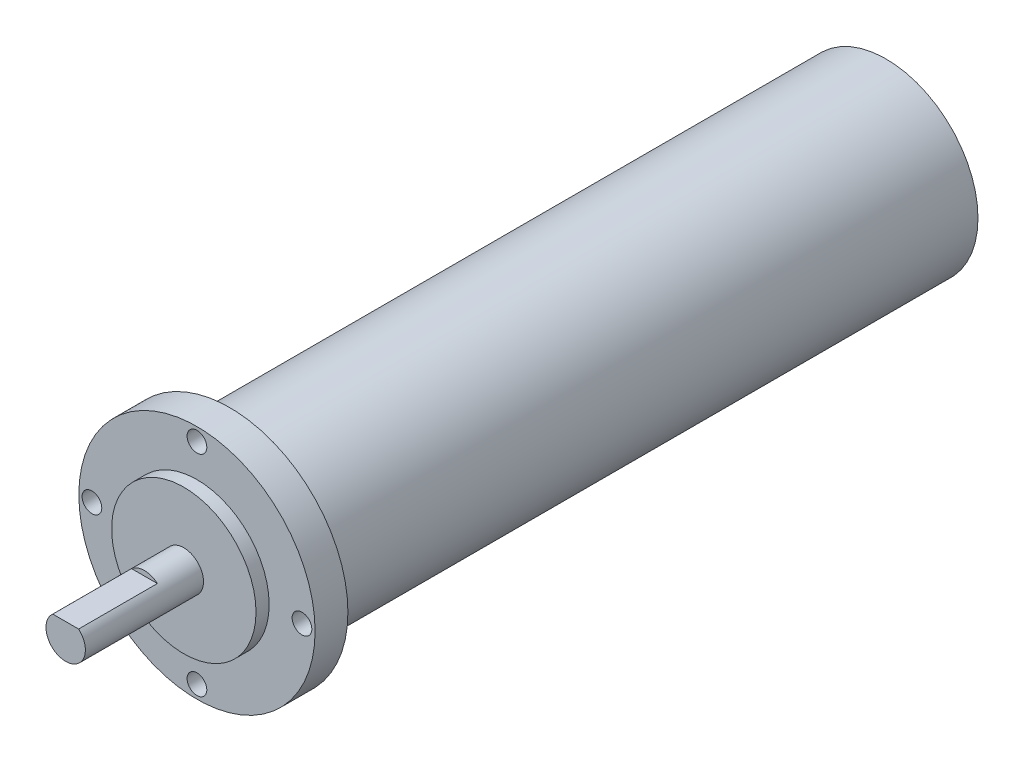
from build123d import *
from build123d.topology import SkipClean

# Parameters (mm, degrees)
SKETCH1_R           = 14
BOSS_EXTRUDE1_DEPTH = 100
SKETCH3_R           = 18
SKETCH3_R_2         = 1.5
BOSS_EXTRUDE2_DEPTH = 5
SKETCH4_R           = 11
BOSS_EXTRUDE3_DEPTH = 2
SKETCH5_R           = 3
BOSS_EXTRUDE4_DEPTH = 6
BOSS_EXTRUDE5_DEPTH = 18


with BuildPart() as part:
    # Sketch1 → Boss-Extrude1 (new body)
    with BuildSketch(Plane.XY):
        Circle(SKETCH1_R)
    extrude(amount=BOSS_EXTRUDE1_DEPTH)

    # Sketch3 → Boss-Extrude2 (add)
    with BuildSketch(Plane.XY.offset(100)):
        Circle(SKETCH3_R)
        with Locations((16, 0)):
            Circle(SKETCH3_R_2, mode=Mode.SUBTRACT)
        with Locations((0, 16)):
            Circle(SKETCH3_R_2, mode=Mode.SUBTRACT)
        with Locations((-16, 0)):
            Circle(SKETCH3_R_2, mode=Mode.SUBTRACT)
        with Locations((0, -16)):
            Circle(SKETCH3_R_2, mode=Mode.SUBTRACT)
    extrude(amount=BOSS_EXTRUDE2_DEPTH)


with BuildPart() as body_2:
    # Sketch4 → Boss-Extrude3 (new body)
    with BuildSketch(Plane.XY.offset(105)):
        Circle(SKETCH4_R)
    extrude(amount=BOSS_EXTRUDE3_DEPTH)

    # Sketch5 → Boss-Extrude4 (add)
    with BuildSketch(Plane.XY.offset(107)):
        Circle(SKETCH5_R)
    extrude(amount=BOSS_EXTRUDE4_DEPTH)

    # Sketch7 → Boss-Extrude5 (add)
    with SkipClean():  # the faces are left unmerged after this step: merging them gives an invalid solid
        with BuildSketch(Plane.XY.offset(107)):
            with BuildLine():
                Line((-1.969853899, 2.262670019), (1.969853899, 2.262670019))
                ThreePointArc((1.969853899, 2.262670019), (2.730344456, 1.243068442), (3, 0))
                ThreePointArc((3, 0), (0, -3), (-3, 0))
                ThreePointArc((-3, 0), (-2.730344456, 1.243068442), (-1.969853899, 2.262670019))
            make_face()
        extrude(amount=BOSS_EXTRUDE5_DEPTH)


solid = Compound([part.part, body_2.part])
